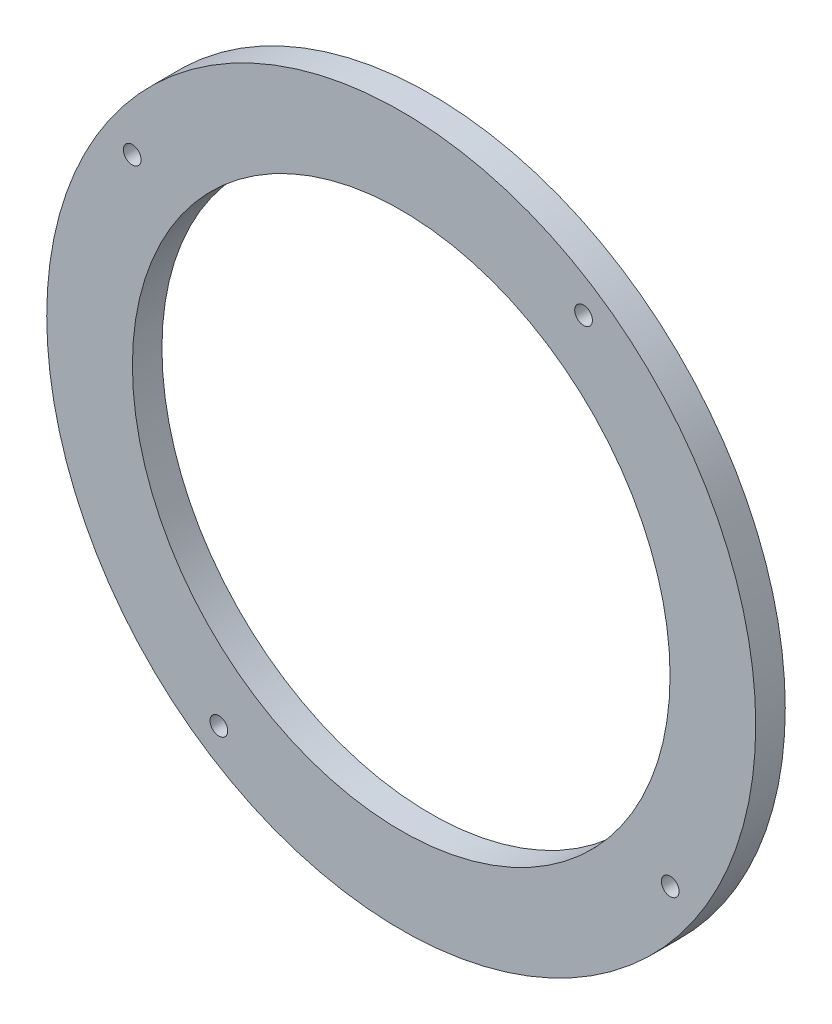
from build123d import *

# Parameters (mm, degrees)
SKETCH_1_R          = 60
SKETCH_1_R_2        = 45.5
EXTRUDE_1_DEPTH     = 5
SKETCH_2_R          = 1.5
CUT_EXTRUDE_1_DEPTH = 5


with BuildPart() as part:
    # 草图1 → 凸台-拉伸1 (new body)
    with BuildSketch(Plane.XY):
        Circle(SKETCH_1_R)
        Circle(SKETCH_1_R_2, mode=Mode.SUBTRACT)
    extrude(amount=EXTRUDE_1_DEPTH)

    # 草图2 → 切除-拉伸1 (cut)
    with BuildSketch(Plane.XY.offset(5)):
        with Locations((-30.859907929, -45.526542616)):
            Circle(SKETCH_2_R)
        with Locations((-45.526542616, 30.859907929)):
            Circle(SKETCH_2_R)
        with Locations((30.859907929, 45.526542616)):
            Circle(SKETCH_2_R)
        with Locations((45.526542616, -30.859907929)):
            Circle(SKETCH_2_R)
    extrude(amount=-CUT_EXTRUDE_1_DEPTH, mode=Mode.SUBTRACT)


solid = part.part
